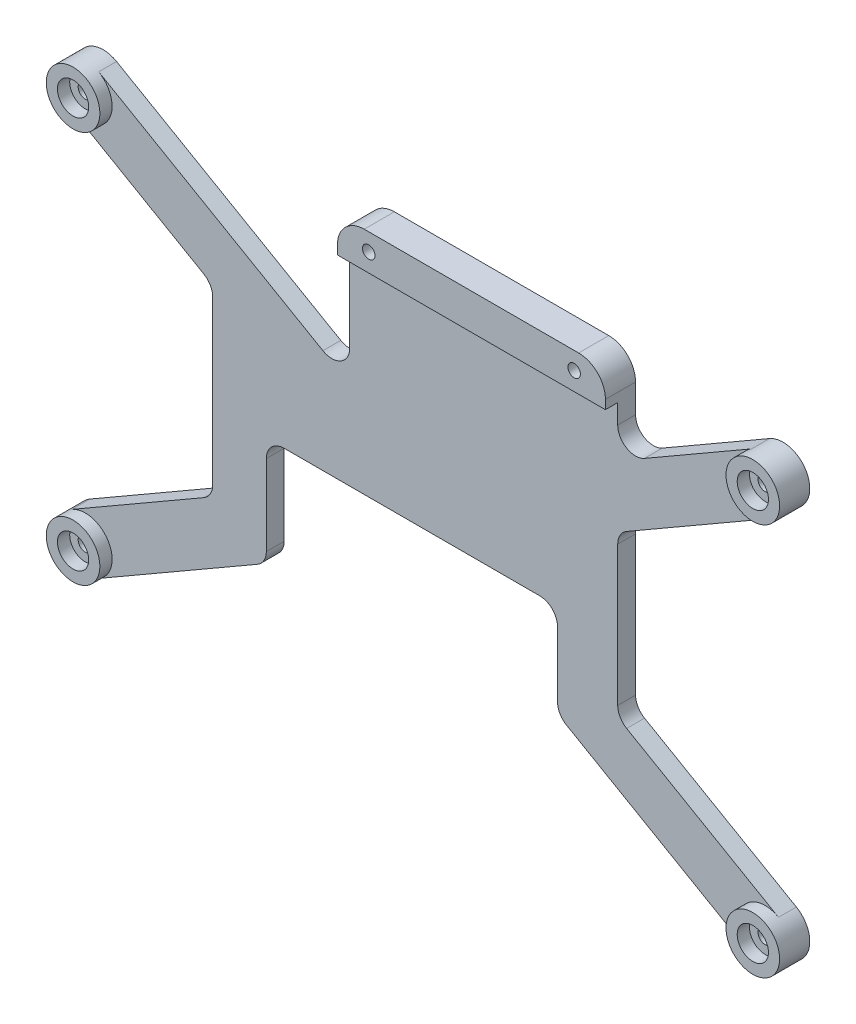
from build123d import *

# Parameters (mm, degrees)
BOSS_EXTRUDE1_DEPTH = 2
SKETCH2_R           = 3
SKETCH2_R_2         = 1.75
BOSS_EXTRUDE2_DEPTH = 1.3744
FILLET1_R           = 2
CUT_EXTRUDE1_REACH  = 154.581
SKETCH3_R           = 0.8
SKETCH6_W           = 30
SKETCH6_H           = 4
BOSS_EXTRUDE4_DEPTH = 1.3744
SKETCH7_R           = 0.7
CUT_EXTRUDE3_DEPTH  = 153.581315805
FILLET2_R           = 3


with BuildPart() as part:
    # Sketch1 → Boss-Extrude1 (new body)
    with BuildSketch(Plane.XY):
        with BuildLine():
            Line((47.808137976, 76.172186055), (63.568277585, 67.076965299))
            Line((63.568277585, 67.076965299), (63.568277585, 46.547516))
            Line((63.568277585, 46.547516), (47.808137976, 37.452295245))
            ThreePointArc((47.808137976, 37.452295245), (46.709301103, 33.354422928), (50.80717342, 32.255586055))
            Line((50.80717342, 32.255586055), (69.568277585, 43.082671869))
            Line((69.568277585, 43.082671869), (69.568277585, 55.255795635))
            Line((69.568277585, 55.255795635), (102.168277585, 55.255795635))
            Line((102.168277585, 55.255795635), (102.168277585, 44.800797075))
            Line((102.168277585, 44.800797075), (123.906537976, 32.255586055))
            ThreePointArc((123.906537976, 32.255586055), (128.004410293, 33.354422928), (126.90557342, 37.452295245))
            Line((126.90557342, 37.452295245), (108.905229152, 47.84034439))
            Line((108.905229152, 47.84034439), (108.905229152, 65.784136909))
            Line((108.905229152, 65.784136909), (126.90557342, 76.172186055))
            ThreePointArc((126.90557342, 76.172186055), (128.004410293, 80.270058372), (123.906537976, 81.368895245))
            Line((123.906537976, 81.368895245), (108.905229152, 72.711597862))
            Line((108.905229152, 72.711597862), (108.905229152, 82.35020472))
            Line((108.905229152, 82.35020472), (78.905229152, 82.35020472))
            Line((78.905229152, 82.35020472), (78.905229152, 65.153428503))
            Line((78.905229152, 65.153428503), (50.80717342, 81.368895245))
            ThreePointArc((50.80717342, 81.368895245), (46.709301103, 80.270058372), (47.808137976, 76.172186055))
        make_face()
    extrude(amount=BOSS_EXTRUDE1_DEPTH)

    # Sketch2 → Boss-Extrude2 (add)
    # profile 1 of 4: a face of its own
    with BuildSketch(Plane.XY.offset(2)):
        with Locations(Location((49.307655698, 78.77054065, 0), (0, 0, 180))):
            Circle(SKETCH2_R)
        with Locations(Location((49.307655698, 78.77054065, 0), (0, 0, 180))):
            Circle(SKETCH2_R_2, mode=Mode.SUBTRACT)
    # profile 2 of 4: a face of its own
    with BuildSketch(Plane.XY.offset(2)):
        with Locations(Location((49.307655698, 34.85394065, 0), (0, 0, 180))):
            Circle(SKETCH2_R)
        with Locations(Location((49.307655698, 34.85394065, 0), (0, 0, 180))):
            Circle(SKETCH2_R_2, mode=Mode.SUBTRACT)
    # profile 3 of 4: a face of its own
    with BuildSketch(Plane.XY.offset(2)):
        with Locations(Location((125.406055698, 34.85394065, 0), (0, 0, 180))):
            Circle(SKETCH2_R)
        with Locations(Location((125.406055698, 34.85394065, 0), (0, 0, 180))):
            Circle(SKETCH2_R_2, mode=Mode.SUBTRACT)
    # profile 4 of 4: a face of its own
    with BuildSketch(Plane.XY.offset(2)):
        with Locations(Location((125.406055698, 78.77054065, 0), (0, 0, 180))):
            Circle(SKETCH2_R)
        with Locations(Location((125.406055698, 78.77054065, 0), (0, 0, 180))):
            Circle(SKETCH2_R_2, mode=Mode.SUBTRACT)
    extrude(amount=BOSS_EXTRUDE2_DEPTH)

    # Fillet1
    fillet1_edges = [part.edges().sort_by_distance(p)[0] for p in [
        (69.568277585, 43.082671869, 1),
        (63.568277585, 46.547516, 1),
        (63.568277585, 67.076965299, 1),
        (78.905229152, 65.153428503, 1),
        (108.905229152, 72.711597862, 1),
        (108.905229152, 65.784136909, 1),
        (108.905229152, 47.84034439, 1),
        (102.168277585, 44.800797075, 1),
        (102.168277585, 55.255795635, 1),
        (69.568277585, 55.255795635, 1),
    ]]
    fillet(fillet1_edges, radius=FILLET1_R)

    # Sketch3 → Cut-Extrude1 (cut, up to next)
    with BuildSketch(Plane(origin=(0, 0, 0), x_dir=(-1, 0, 0), z_dir=(0, 0, -1)), mode=Mode.PRIVATE) as cut_extrude1_sk1:
        with Locations((-125.406055698, 78.77054065)):
            Circle(SKETCH3_R)
    cut_extrude1_tool1 = extrude(cut_extrude1_sk1.sketch, amount=-CUT_EXTRUDE1_REACH, mode=Mode.PRIVATE) & part.part
    # Sketch3 → Cut-Extrude1 (cut, up to next)
    with BuildSketch(Plane(origin=(0, 0, 0), x_dir=(-1, 0, 0), z_dir=(0, 0, -1)), mode=Mode.PRIVATE) as cut_extrude1_sk2:
        with Locations((-125.406055698, 34.85394065)):
            Circle(SKETCH3_R)
    cut_extrude1_tool2 = extrude(cut_extrude1_sk2.sketch, amount=-CUT_EXTRUDE1_REACH, mode=Mode.PRIVATE) & part.part
    # Sketch3 → Cut-Extrude1 (cut, up to next)
    with BuildSketch(Plane(origin=(0, 0, 0), x_dir=(-1, 0, 0), z_dir=(0, 0, -1)), mode=Mode.PRIVATE) as cut_extrude1_sk3:
        with Locations((-49.307655698, 34.85394065)):
            Circle(SKETCH3_R)
    cut_extrude1_tool3 = extrude(cut_extrude1_sk3.sketch, amount=-CUT_EXTRUDE1_REACH, mode=Mode.PRIVATE) & part.part
    # Sketch3 → Cut-Extrude1 (cut, up to next)
    with BuildSketch(Plane(origin=(0, 0, 0), x_dir=(-1, 0, 0), z_dir=(0, 0, -1)), mode=Mode.PRIVATE) as cut_extrude1_sk4:
        with Locations((-49.307655698, 78.77054065)):
            Circle(SKETCH3_R)
    cut_extrude1_tool4 = extrude(cut_extrude1_sk4.sketch, amount=-CUT_EXTRUDE1_REACH, mode=Mode.PRIVATE) & part.part
    add(cut_extrude1_tool1.solids().sort_by_distance((125.406056, 78.770541, 0))[0], mode=Mode.SUBTRACT)
    add(cut_extrude1_tool2.solids().sort_by_distance((125.406056, 34.853941, 0))[0], mode=Mode.SUBTRACT)
    add(cut_extrude1_tool3.solids().sort_by_distance((49.307656, 34.853941, 0))[0], mode=Mode.SUBTRACT)
    add(cut_extrude1_tool4.solids().sort_by_distance((49.307656, 78.770541, 0))[0], mode=Mode.SUBTRACT)

    # Sketch6 → Boss-Extrude4 (add)
    with BuildSketch(Plane.XY.offset(2)):
        with Locations((93.905229152, 80.35020472)):
            Rectangle(SKETCH6_W, SKETCH6_H)
    extrude(amount=BOSS_EXTRUDE4_DEPTH)

    # Sketch7 → Cut-Extrude3 (cut, through all)
    with BuildSketch(Plane(origin=(0, 0, 0), x_dir=(-1, 0, 0), z_dir=(0, 0, -1))):
        with Locations((-105.405229152, 80.39430472)):
            Circle(SKETCH7_R)
        with Locations(Location((-82.405229152, 80.39430472, 0), (0, 0, 180))):
            Circle(SKETCH7_R)
    extrude(amount=-CUT_EXTRUDE3_DEPTH, mode=Mode.SUBTRACT)

    # Fillet2
    fillet2_edges = [part.edges().sort_by_distance(p)[0] for p in [
        (78.905229152, 82.35020472, 1.6872),
        (108.905229152, 82.35020472, 1.6872),
    ]]
    fillet(fillet2_edges, radius=FILLET2_R)


solid = part.part
